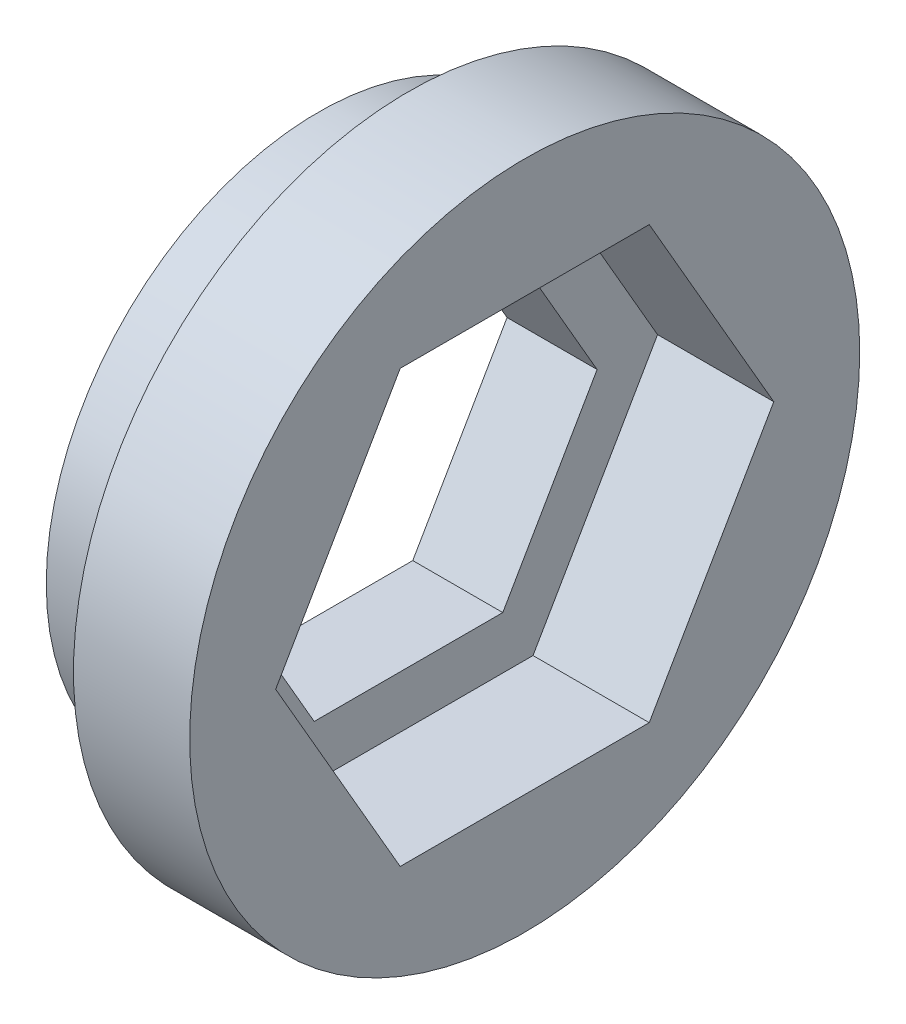
from build123d import *

# Parameters (mm, degrees)
SKETCH1_R           = 10.16
BOSS_EXTRUDE1_DEPTH = 1.762125
SKETCH2_R           = 8.255
BOSS_EXTRUDE2_DEPTH = 2.7305
FILLET1_R           = 1.27


with BuildPart() as part:
    # Sketch1 → Boss-Extrude1 (new, symmetric)
    with BuildSketch(Plane(origin=(0, 0, 0), x_dir=(0, 0, -1), z_dir=(1, 0, 0))):
        Circle(SKETCH1_R)
        Polygon((7.552318871, 0), (3.776159436, 6.5405), (-3.776159436, 6.5405), (-7.552318871, 0), (-3.776159436, -6.5405), (3.776159436, -6.5405), align=None, mode=Mode.SUBTRACT)
    extrude(amount=BOSS_EXTRUDE1_DEPTH, both=True)

    # Sketch2 → Boss-Extrude2 (add)
    with BuildSketch(Plane.ZY.offset(1.762125)):
        with Locations(Location((0, 0, 0), (0, 0, 180))):
            Circle(SKETCH2_R)
        Polygon((5.719231767, 0), (2.859615883, 4.953), (-2.859615883, 4.953), (-5.719231767, 0), (-2.859615883, -4.953), (2.859615883, -4.953), align=None, mode=Mode.SUBTRACT)
    extrude(amount=BOSS_EXTRUDE2_DEPTH)

    # Fillet1
    fillet1_edges = [part.edges().sort_by_distance(p)[0] for p in [
        (-1.762125, 0, 8.255),
    ]]
    fillet(fillet1_edges, radius=FILLET1_R)


solid = part.part
